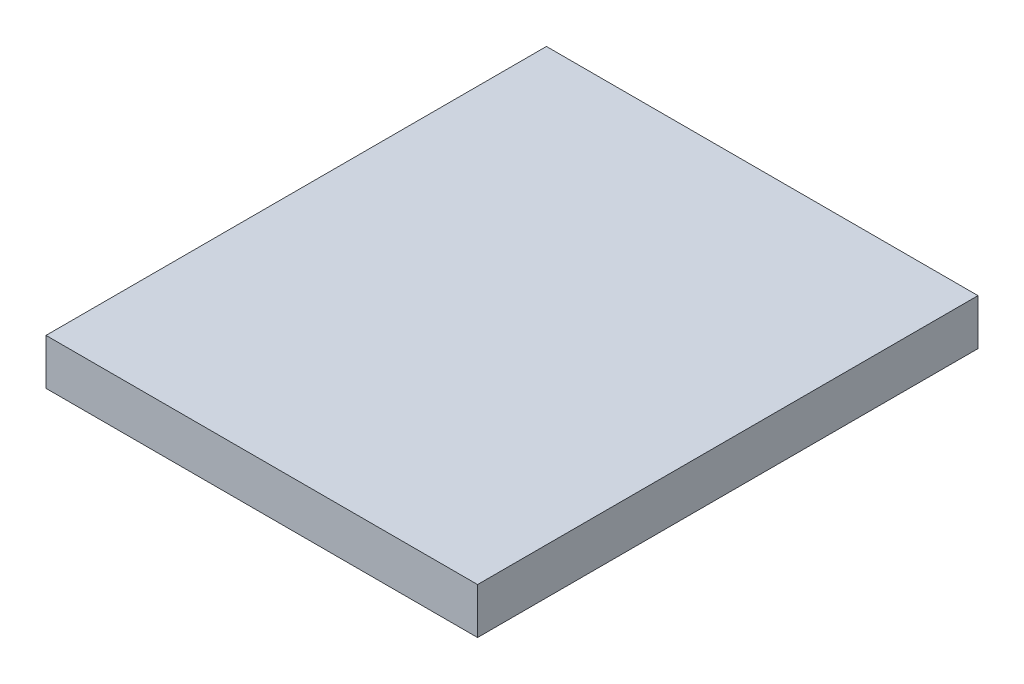
from build123d import *

# Parameters (mm, degrees)
SKETCH1_W           = 94
SKETCH1_H           = 109
BOSS_EXTRUDE1_DEPTH = 10
SHELL1_T            = -2


with BuildPart() as part:
    # Sketch1 → Boss-Extrude1 (new body)
    with BuildSketch(Plane(origin=(0, 0, 0), x_dir=(1, 0, 0), z_dir=(0, 1, 0))):
        Rectangle(SKETCH1_W, SKETCH1_H)
    extrude(amount=BOSS_EXTRUDE1_DEPTH)

    # Shell1
    shell1_openings = [part.faces().sort_by_distance(p)[0] for p in [
        (0, 0, 0),
    ]]
    offset(amount=SHELL1_T, openings=shell1_openings, kind=Kind.INTERSECTION)


solid = part.part
